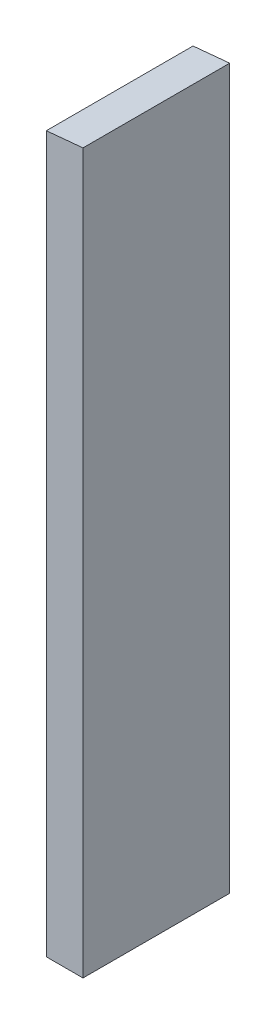
from build123d import *

# Parameters (mm, degrees)
BOSS_EXTRUDE1_DEPTH = 25.4


with BuildPart() as part:
    # Sketch1 → Boss-Extrude1 (new body)
    with BuildSketch(Plane.XY):
        Polygon((0, 0), (6.35, 0), (6.35, 124.46), (0, 123.859748272), align=None)
    extrude(amount=BOSS_EXTRUDE1_DEPTH)


solid = part.part
